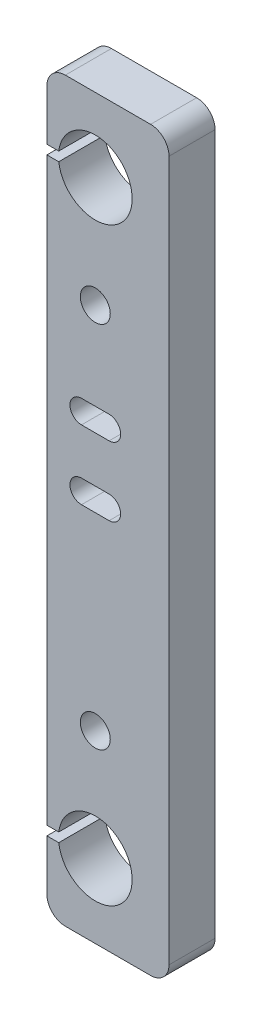
from build123d import *

# Parameters (mm, degrees)
SKETCH1_W           = 16
SKETCH1_H           = 80
SKETCH1_R           = 4
SKETCH1_R_2         = 1.625
BOSS_EXTRUDE1_DEPTH = 5
CUT_EXTRUDE3_DEPTH  = 82.737384348
SKETCH4_W           = 2.75
SKETCH4_H           = 80
CUT_EXTRUDE4_DEPTH  = 82.737384348
FILLET1_R           = 2


with BuildPart() as part:
    # Sketch1 → Boss-Extrude1 (new body)
    with BuildSketch(Plane.XY):
        with Locations((8, 40)):
            Rectangle(SKETCH1_W, SKETCH1_H)
        with Locations((8, 72)):
            Circle(SKETCH1_R, mode=Mode.SUBTRACT)
        with Locations((8, 8)):
            Circle(SKETCH1_R, mode=Mode.SUBTRACT)
        with Locations((8, 20)):
            Circle(SKETCH1_R_2, mode=Mode.SUBTRACT)
        with Locations((8, 60)):
            Circle(SKETCH1_R_2, mode=Mode.SUBTRACT)
        with BuildLine():
            Line((6.5, 50.5), (9.5, 50.5))
            ThreePointArc((9.5, 50.5), (10.75, 49.25), (9.5, 48))
            Line((9.5, 48), (6.5, 48))
            ThreePointArc((6.5, 48), (5.25, 49.25), (6.5, 50.5))
        make_face(mode=Mode.SUBTRACT)
        with BuildLine():
            Line((6.5, 43), (9.5, 43))
            ThreePointArc((9.5, 43), (10.75, 41.75), (9.5, 40.5))
            Line((9.5, 40.5), (6.5, 40.5))
            ThreePointArc((6.5, 40.5), (5.25, 41.75), (6.5, 43))
        make_face(mode=Mode.SUBTRACT)
    extrude(amount=BOSS_EXTRUDE1_DEPTH)

    # Sketch3 → Cut-Extrude3 (cut, through all)
    with BuildSketch(Plane(origin=(0, 0, 0), x_dir=(-1, 0, 0), z_dir=(0, 0, -1))):
        with BuildLine():
            Line((-8, 72.5), (0, 72.5))
            ThreePointArc((0, 72.5), (0.5, 72), (0, 71.5))
            Line((0, 71.5), (-8, 71.5))
            ThreePointArc((-8, 71.5), (-8.5, 72), (-8, 72.5))
        make_face()
        with BuildLine():
            Line((-8, 8.5), (0, 8.5))
            ThreePointArc((0, 8.5), (0.5, 8), (0, 7.5))
            Line((0, 7.5), (-8, 7.5))
            ThreePointArc((-8, 7.5), (-8.5, 8), (-8, 8.5))
        make_face()
    extrude(amount=-CUT_EXTRUDE3_DEPTH, mode=Mode.SUBTRACT)

    # Sketch4 → Cut-Extrude4 (cut, through all)
    with BuildSketch(Plane(origin=(0, 0, 0), x_dir=(-1, 0, 0), z_dir=(0, 0, -1))):
        with Locations((-1.375, 40)):
            Rectangle(SKETCH4_W, SKETCH4_H)
    extrude(amount=-CUT_EXTRUDE4_DEPTH, mode=Mode.SUBTRACT)

    # Fillet1
    fillet1_edges = [part.edges().sort_by_distance(p)[0] for p in [
        (2.75, 0, 2.5),
        (2.75, 80, 2.5),
        (16, 80, 2.5),
        (16, 0, 2.5),
    ]]
    fillet(fillet1_edges, radius=FILLET1_R)


solid = part.part
